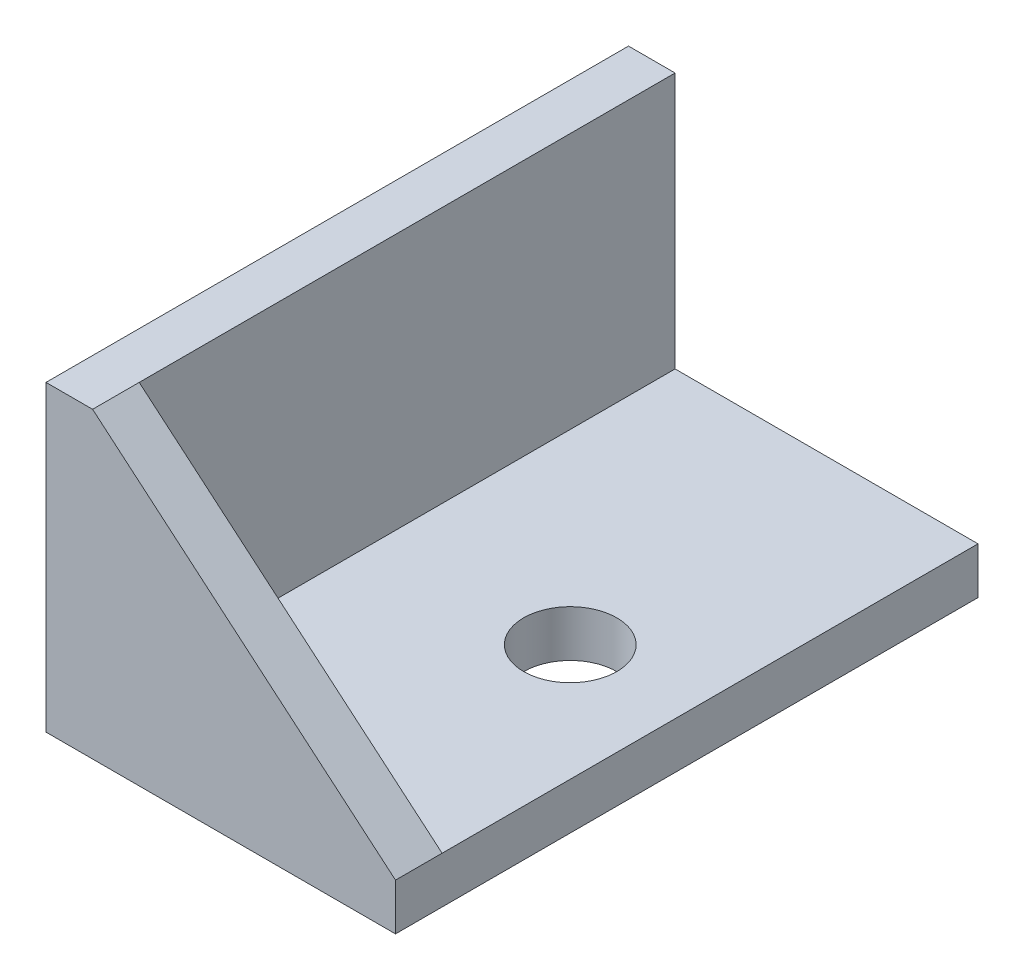
from build123d import *

# Parameters (mm, degrees)
DODANIE_WYCI_GNI_CIE1_DEPTH = 125
DODANIE_WYCI_GNI_CIE3_DEPTH = 10
SZKIC4_R                    = 10
WYTNIJ_WYCI_GNI_CIE1_DEPTH  = 10


with BuildPart() as part:
    # Szkic2 → Dodanie-wyciągnięcie1 (new body)
    with BuildSketch(Plane.XY):
        Polygon((0, 0), (0, 65), (10, 65), (10, 10), (75, 10), (75, 0), align=None)
    extrude(amount=-DODANIE_WYCI_GNI_CIE1_DEPTH)

    # Szkic3 → Dodanie-wyciągnięcie3 (add)
    with BuildSketch(Plane.XY):
        Polygon((10, 65), (75, 10), (10, 10), align=None)
    extrude(amount=-DODANIE_WYCI_GNI_CIE3_DEPTH)

    # Szkic4 → Wytnij-wyciągnięcie1 (cut)
    with BuildSketch(Plane(origin=(0, 10, 0), x_dir=(1, 0, 0), z_dir=(0, 1, 0))):
        with Locations(Location((50, 62.5, 0), (0, 0, 180))):
            Circle(SZKIC4_R)
    extrude(amount=-WYTNIJ_WYCI_GNI_CIE1_DEPTH, mode=Mode.SUBTRACT)


solid = part.part
